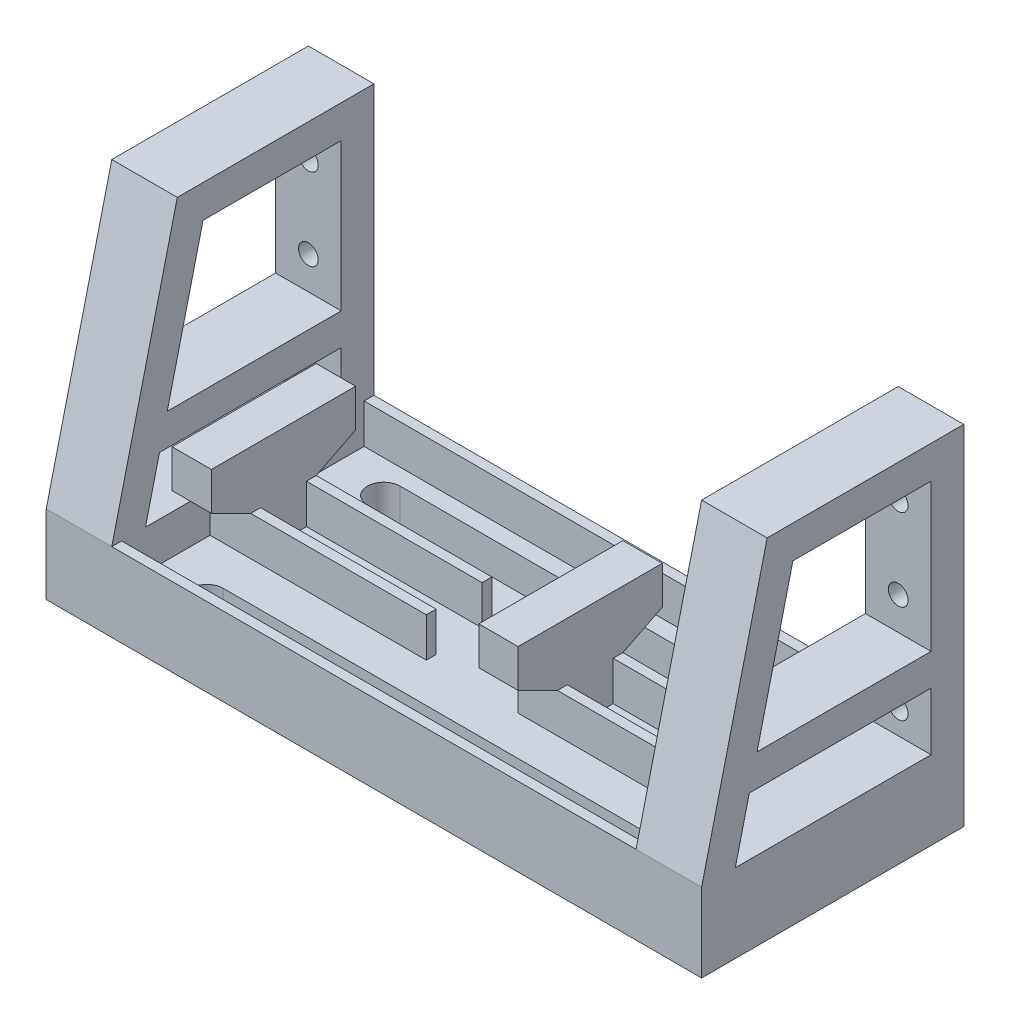
from build123d import *

# Parameters (mm, degrees)
BOSS_EXTRUDE1_DEPTH  = 80
BOSS_EXTRUDE2_DEPTH  = 6
BOSS_EXTRUDE3_DEPTH  = 6
CUT_EXTRUDE1_REACH   = 93.829
SKETCH6_W            = 14
SKETCH6_H            = 10
CUT_EXTRUDE2_DEPTH   = 6
BOSS_EXTRUDE4_DEPTH  = 10
BOSS_EXTRUDE11_DEPTH = 10
CUT_EXTRUDE3_REACH   = 113.919
SKETCH9_R            = 1.5


with BuildPart() as part:
    # Sketch1 → Boss-Extrude1 (new body)
    with BuildSketch(Plane(origin=(0, 0, 0), x_dir=(0, 0, -1), z_dir=(1, 0, 0))):
        Polygon((0, 0), (40, 0), (40, 12), (38.5, 12), (38.5, 6), (25, 6), (25, 12), (23.5, 12), (23.5, 6), (16.5, 6), (16.5, 12), (15, 12), (15, 6), (1.5, 6), (1.5, 12), (0, 12), align=None)
    extrude(amount=BOSS_EXTRUDE1_DEPTH)

    # Sketch2 → Boss-Extrude2 (add)
    with BuildSketch(Plane(origin=(6.2, 0, 0), x_dir=(0, 0, -1), z_dir=(1, 0, 0))):
        Polygon((15, 6), (15, 12), (9, 15), (9, 20.8), (31, 20.8), (31, 15), (25, 12), (25, 6), align=None)
    extrude(amount=-BOSS_EXTRUDE2_DEPTH)

    # Sketch4 → Boss-Extrude3 (add)
    with BuildSketch(Plane(origin=(47, 0, 0), x_dir=(0, 0, -1), z_dir=(1, 0, 0))):
        Polygon((25, 6), (15, 6), (15, 12), (9, 15), (9, 20.8), (31, 20.8), (31, 15), (25, 12), align=None)
    extrude(amount=BOSS_EXTRUDE3_DEPTH)

    # Sketch5 → Cut-Extrude1 (cut, up to next)
    with BuildSketch(Plane.XZ, mode=Mode.PRIVATE) as cut_extrude1_sk1:
        with BuildLine():
            Line((8, -31), (72, -31))
            ThreePointArc((72, -31), (74.5, -33.5), (72, -36))
            Line((72, -36), (8, -36))
            ThreePointArc((8, -36), (5.5, -33.5), (8, -31))
        make_face()
    cut_extrude1_tool1 = extrude(cut_extrude1_sk1.sketch, amount=-CUT_EXTRUDE1_REACH, mode=Mode.PRIVATE) & part.part
    # Sketch5 → Cut-Extrude1 (cut, up to next)
    with BuildSketch(Plane.XZ, mode=Mode.PRIVATE) as cut_extrude1_sk2:
        with BuildLine():
            Line((72, -4), (8, -4))
            ThreePointArc((8, -4), (5.5, -6.5), (8, -9))
            Line((8, -9), (72, -9))
            ThreePointArc((72, -9), (74.5, -6.5), (72, -4))
        make_face()
    cut_extrude1_tool2 = extrude(cut_extrude1_sk2.sketch, amount=-CUT_EXTRUDE1_REACH, mode=Mode.PRIVATE) & part.part
    add(cut_extrude1_tool1.solids().sort_by_distance((40, 0, -33.5))[0], mode=Mode.SUBTRACT)
    add(cut_extrude1_tool2.solids().sort_by_distance((40, 0, -6.5))[0], mode=Mode.SUBTRACT)

    # Sketch6 → Cut-Extrude2 (cut)
    with BuildSketch(Plane(origin=(0, 6, 0), x_dir=(1, 0, 0), z_dir=(0, 1, 0))):
        with Locations((40, 20)):
            Rectangle(SKETCH6_W, SKETCH6_H)
    extrude(amount=CUT_EXTRUDE2_DEPTH, mode=Mode.SUBTRACT)

    # Sketch7 → Boss-Extrude4 (add)
    with BuildSketch(Plane(origin=(80, 0, 0), x_dir=(0, 0, -1), z_dir=(1, 0, 0))):
        Polygon((0, 0), (40, 0), (40, 12), (40, 53.158651342), (10, 53.158651342), (0, 12), align=None)
        Polygon((35, 48.158651342), (13.930649368, 48.158651342), (8.463997944, 25.658651342), (35, 25.658651342), align=None, mode=Mode.SUBTRACT)
        Polygon((35, 20.8), (7.283528909, 20.8), (5.145460796, 12), (35, 12), align=None, mode=Mode.SUBTRACT)
    extrude(amount=BOSS_EXTRUDE4_DEPTH)

    # Sketch8 → Boss-Extrude11 (add)
    with BuildSketch(Plane.ZY):
        Polygon((0, 12), (0, 0), (-40, 0), (-40, 12), (-40, 53.158651342), (-10, 53.158651342), align=None)
        Polygon((-5.145460796, 12), (-35, 12), (-35, 20.8), (-7.283528909, 20.8), align=None, mode=Mode.SUBTRACT)
        Polygon((-13.930649368, 48.158651342), (-8.463997944, 25.658651342), (-35, 25.658651342), (-35, 48.158651342), align=None, mode=Mode.SUBTRACT)
    extrude(amount=BOSS_EXTRUDE11_DEPTH)

    # Sketch9 → Cut-Extrude3 (cut, up to next)
    with BuildSketch(Plane(origin=(0, 0, -40), x_dir=(-1, 0, 0), z_dir=(0, 0, -1)), mode=Mode.PRIVATE) as cut_extrude3_sk1:
        with Locations((-85, 43.158651342)):
            Circle(SKETCH9_R)
    cut_extrude3_tool1 = extrude(cut_extrude3_sk1.sketch, amount=-CUT_EXTRUDE3_REACH, mode=Mode.PRIVATE) & part.part
    # Sketch9 → Cut-Extrude3 (cut, up to next)
    with BuildSketch(Plane(origin=(0, 0, -40), x_dir=(-1, 0, 0), z_dir=(0, 0, -1)), mode=Mode.PRIVATE) as cut_extrude3_sk2:
        with Locations((-85, 30.658651342)):
            Circle(SKETCH9_R)
    cut_extrude3_tool2 = extrude(cut_extrude3_sk2.sketch, amount=-CUT_EXTRUDE3_REACH, mode=Mode.PRIVATE) & part.part
    # Sketch9 → Cut-Extrude3 (cut, up to next)
    with BuildSketch(Plane(origin=(0, 0, -40), x_dir=(-1, 0, 0), z_dir=(0, 0, -1)), mode=Mode.PRIVATE) as cut_extrude3_sk3:
        with Locations((-85, 15.658651342)):
            Circle(SKETCH9_R)
    cut_extrude3_tool3 = extrude(cut_extrude3_sk3.sketch, amount=-CUT_EXTRUDE3_REACH, mode=Mode.PRIVATE) & part.part
    # Sketch9 → Cut-Extrude3 (cut, up to next)
    with BuildSketch(Plane(origin=(0, 0, -40), x_dir=(-1, 0, 0), z_dir=(0, 0, -1)), mode=Mode.PRIVATE) as cut_extrude3_sk4:
        with Locations((5, 43.158651342)):
            Circle(SKETCH9_R)
    cut_extrude3_tool4 = extrude(cut_extrude3_sk4.sketch, amount=-CUT_EXTRUDE3_REACH, mode=Mode.PRIVATE) & part.part
    # Sketch9 → Cut-Extrude3 (cut, up to next)
    with BuildSketch(Plane(origin=(0, 0, -40), x_dir=(-1, 0, 0), z_dir=(0, 0, -1)), mode=Mode.PRIVATE) as cut_extrude3_sk5:
        with Locations((5, 30.658651342)):
            Circle(SKETCH9_R)
    cut_extrude3_tool5 = extrude(cut_extrude3_sk5.sketch, amount=-CUT_EXTRUDE3_REACH, mode=Mode.PRIVATE) & part.part
    # Sketch9 → Cut-Extrude3 (cut, up to next)
    with BuildSketch(Plane(origin=(0, 0, -40), x_dir=(-1, 0, 0), z_dir=(0, 0, -1)), mode=Mode.PRIVATE) as cut_extrude3_sk6:
        with Locations((5, 15.658651342)):
            Circle(SKETCH9_R)
    cut_extrude3_tool6 = extrude(cut_extrude3_sk6.sketch, amount=-CUT_EXTRUDE3_REACH, mode=Mode.PRIVATE) & part.part
    add(cut_extrude3_tool1.solids().sort_by_distance((85, 43.158651, -40))[0], mode=Mode.SUBTRACT)
    add(cut_extrude3_tool2.solids().sort_by_distance((85, 30.658651, -40))[0], mode=Mode.SUBTRACT)
    add(cut_extrude3_tool3.solids().sort_by_distance((85, 15.658651, -40))[0], mode=Mode.SUBTRACT)
    add(cut_extrude3_tool4.solids().sort_by_distance((-5, 43.158651, -40))[0], mode=Mode.SUBTRACT)
    add(cut_extrude3_tool5.solids().sort_by_distance((-5, 30.658651, -40))[0], mode=Mode.SUBTRACT)
    add(cut_extrude3_tool6.solids().sort_by_distance((-5, 15.658651, -40))[0], mode=Mode.SUBTRACT)


solid = part.part
